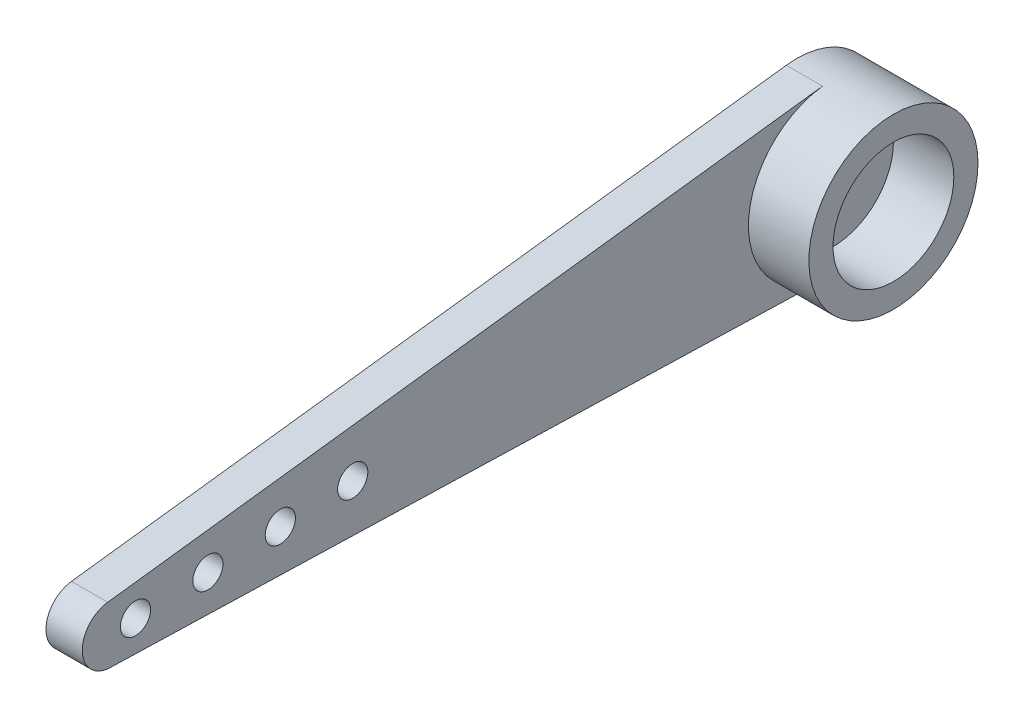
from build123d import *

# Parameters (mm, degrees)
BASE_SKETCH_R            = 0.625
BASE_EXTRUDE_DEPTH       = 1.5
CIRCLE_SKETCH_R          = 3.5
CIRCLE_SKETCH_R_2        = 2.5
CIRCLE_EXTRUDE_DEPTH     = 2.5
SCREW_CIRCLE1_SKETCH_R   = 2.5
SCREW_CIRCLE_1_CUT_DEPTH = 0.6
SCREW_CIRCLE2_SKETCH_R   = 1
SCREW_CIRCLE_CUT_DEPTH   = 77.422014171


with BuildPart() as part:
    # Base Sketch → Base Extrude (new body)
    with BuildSketch(Plane.ZY.offset(4)):
        with BuildLine():
            Line((-71.399880191, 12.177847643), (-41.820115259, 8.471741587))
            ThreePointArc((-41.820115259, 8.471741587), (-40.765509681, 7.276309847), (-41.821002543, 6.081661451))
            Line((-41.821002543, 6.081661451), (-71.732639675, 5.206497125))
            ThreePointArc((-71.732639675, 5.206497125), (-75.331019627, 8.871873504), (-71.399880191, 12.177847643))
        make_face()
        with Locations((-45.965270944, 7.46783075)):
            Circle(BASE_SKETCH_R, mode=Mode.SUBTRACT)
        with Locations((-48.961846252, 7.611136109)):
            Circle(BASE_SKETCH_R, mode=Mode.SUBTRACT)
        with Locations((-51.958421559, 7.754441469)):
            Circle(BASE_SKETCH_R, mode=Mode.SUBTRACT)
        with Locations((-42.968695636, 7.32452539)):
            Circle(BASE_SKETCH_R, mode=Mode.SUBTRACT)
    extrude(amount=-BASE_EXTRUDE_DEPTH)

    # Circle Sketch → Circle Extrude (add)
    with BuildSketch(Plane(origin=(-2.5, 0, 0), x_dir=(0, 0, -1), z_dir=(1, 0, 0))):
        with Locations(Location((71.835, 8.705, 0), (0, 0, 97.141485201))):
            Circle(CIRCLE_SKETCH_R)
        with Locations((71.835, 8.705)):
            Circle(CIRCLE_SKETCH_R_2, mode=Mode.SUBTRACT)
    extrude(amount=CIRCLE_EXTRUDE_DEPTH)

    # Screw Circle1 Sketch → Screw Circle 1 Cut (cut)
    with BuildSketch(Plane.ZY.offset(4)):
        with Locations(Location((-71.835, 8.705, 0), (0, 0, 180))):
            Circle(SCREW_CIRCLE1_SKETCH_R)
    extrude(amount=-SCREW_CIRCLE_1_CUT_DEPTH, mode=Mode.SUBTRACT)

    # Screw Circle2 Sketch → Screw Circle Cut (cut, through all)
    with BuildSketch(Plane.ZY.offset(4)):
        with Locations((-71.835, 8.705)):
            Circle(SCREW_CIRCLE2_SKETCH_R)
    extrude(amount=-SCREW_CIRCLE_CUT_DEPTH, mode=Mode.SUBTRACT)


solid = part.part
